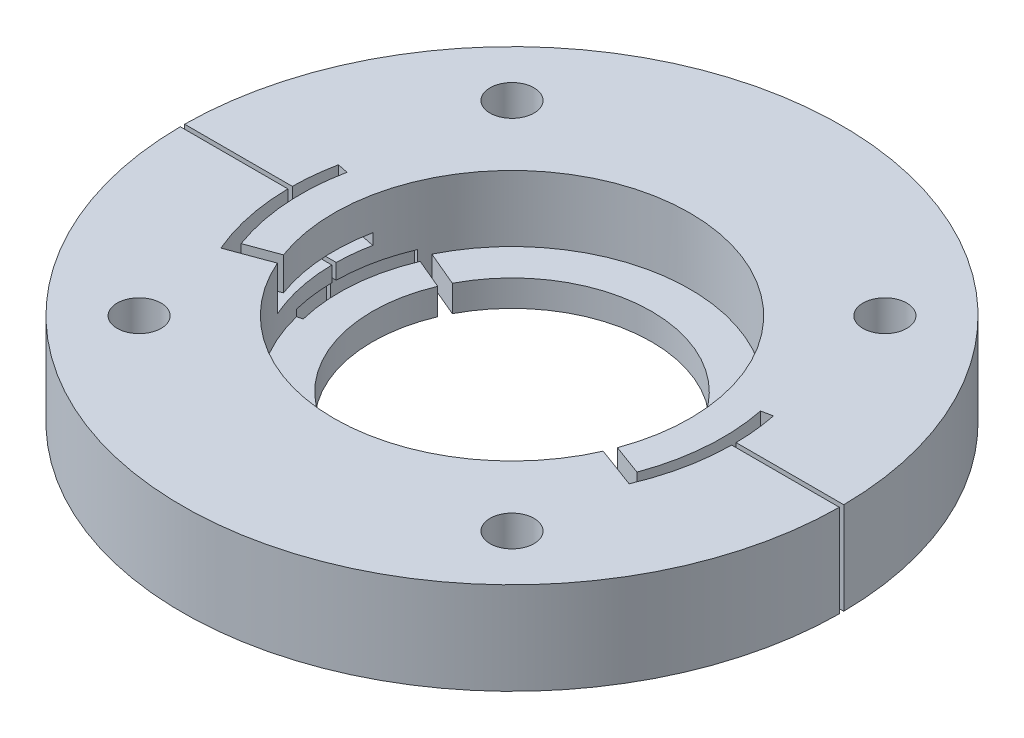
from build123d import *

# Parameters (mm, degrees)
SKETCH4_R           = 1
CUT_EXTRUDE2_DEPTH  = 25.879710609
SKETCH4_3_R         = 1.75
SKETCH4_3_R_2       = 1
CUT_EXTRUDE3_DEPTH  = 9.4
CHAMFER1_SIZE       = 1
SKETCH2_W           = 41.708786628
SKETCH2_H           = 54.576605706
CUT_EXTRUDE1_DEPTH  = 0.05
SKETCH1_5_W         = 6.9
SKETCH1_5_H         = 3
SKETCH1_5_H_2       = 1.2
SKETCH4_4_R         = 1
CUT_EXTRUDE4_DEPTH  = 27.813429471
SKETCH5_R           = 1.75
CUT_EXTRUDE5_DEPTH  = 2.9
CUT_EXTRUDE8_DEPTH  = 2
BOSS_EXTRUDE1_DEPTH = 1.5
CUT_EXTRUDE9_START  = -1.5
CUT_EXTRUDE9_DEPTH  = 1.8
BOSS_EXTRUDE2_DEPTH = 1.2
SKETCH10_W          = 7.7
SKETCH10_H          = 10
SKETCH10_W_2        = 1.8
SKETCH10_H_2        = 3.6
CUT_EXTRUDE10_DEPTH = 0.1
CUT_EXTRUDE11_DEPTH = 1.2


with BuildPart() as part:
    # Sketch1 → Revolve1 (revolve)
    with BuildSketch(Plane.XY, mode=Mode.PRIVATE) as revolve1_sk:
        Polygon((-3, 0), (-8, 0), (-8, -3.7), (-6, -3.7), (-6, -9.7), (-8, -9.7), (-8, -13), (-15, -13), (-15, -23.9), (-6.1, -23.9), (-6.1, -21), (-8.1, -21), (-8.1, -14.3), (-3, -14.3), align=None)
    revolve(revolve1_sk.sketch.rotate(Axis((0, 21.737527327, 0), (0, -1, 0)), 270), axis=Axis((0, 21.737527327, 0), (0, -1, 0)))

    # Sketch4 → Cut-Extrude2 (cut, through all)
    with BuildSketch(Plane(origin=(0, -13, 0), x_dir=(1, 0, 0), z_dir=(0, 1, 0))):
        with Locations(Location((-8.485281374, 8.485281374, 0), (0, 0, 270))):
            Circle(SKETCH4_R)
        with Locations(Location((8.485281374, 8.485281374, 0), (0, 0, 270))):
            Circle(SKETCH4_R)
        with Locations(Location((8.485281374, -8.485281374, 0), (0, 0, 270))):
            Circle(SKETCH4_R)
        with Locations(Location((-8.485281374, -8.485281374, 0), (0, 0, 270))):
            Circle(SKETCH4_R)
    extrude(amount=-CUT_EXTRUDE2_DEPTH, mode=Mode.SUBTRACT)

    # Sketch4<3> → Cut-Extrude3 (cut)
    # profile 1 of 5: a face of its own
    with BuildSketch(Plane(origin=(0, -13, 0), x_dir=(1, 0, 0), z_dir=(0, 1, 0))):
        with Locations(Location((8.485281374, 8.485281374, 0), (0, 0, 270))):
            Circle(SKETCH4_3_R)
        with Locations(Location((8.485281374, 8.485281374, 0), (0, 0, 270))):
            Circle(SKETCH4_3_R_2, mode=Mode.SUBTRACT)
    # profile 2 of 5: a face of its own
    with BuildSketch(Plane(origin=(0, -13, 0), x_dir=(1, 0, 0), z_dir=(0, 1, 0))):
        with Locations(Location((8.485281374, -8.485281374, 0), (0, 0, 270))):
            Circle(SKETCH4_3_R)
        with Locations(Location((8.485281374, -8.485281374, 0), (0, 0, 270))):
            Circle(SKETCH4_3_R_2, mode=Mode.SUBTRACT)
    # profile 3 of 5: a face of its own
    with BuildSketch(Plane(origin=(0, -13, 0), x_dir=(1, 0, 0), z_dir=(0, 1, 0))):
        with Locations(Location((-8.485281374, -8.485281374, 0), (0, 0, 270))):
            Circle(SKETCH4_3_R)
        with Locations(Location((-8.485281374, -8.485281374, 0), (0, 0, 270))):
            Circle(SKETCH4_3_R_2, mode=Mode.SUBTRACT)
    # profile 4 of 5: a face of its own
    with BuildSketch(Plane(origin=(0, -13, 0), x_dir=(1, 0, 0), z_dir=(0, 1, 0))):
        with Locations(Location((-8.485281374, 8.485281374, 0), (0, 0, 270))):
            Circle(SKETCH4_3_R_2)
    # profile 5 of 5: a face of its own
    with BuildSketch(Plane(origin=(0, -13, 0), x_dir=(1, 0, 0), z_dir=(0, 1, 0))):
        with Locations(Location((-8.485281374, 8.485281374, 0), (0, 0, 270))):
            Circle(SKETCH4_3_R)
    extrude(amount=-CUT_EXTRUDE3_DEPTH, mode=Mode.SUBTRACT)

    # Chamfer1
    chamfer1_edges = [part.edges().sort_by_distance(p)[0] for p in [
        (0, 0, -3),
    ]]
    chamfer(chamfer1_edges, length=CHAMFER1_SIZE)

    # Sketch2 → Cut-Extrude1 (cut, symmetric)
    with BuildSketch(Plane.XY):
        Rectangle(SKETCH2_W, SKETCH2_H)
    extrude(amount=CUT_EXTRUDE1_DEPTH, both=True, mode=Mode.SUBTRACT)


with BuildPart() as cut_extrude1_piece_1:
    # of the separate pieces the step leaves, piece 1, a body of its own (cut_extrude1_pieces)
    add(part.part.solids().sort_by_distance((-2.999583304, -1, 0.05))[0])


with BuildPart() as cut_extrude1_piece_2:
    # of the separate pieces the step leaves, piece 2, a body of its own (cut_extrude1_pieces)
    add(part.part.solids().sort_by_distance((-2.999583304, -1, -0.05))[0])


with BuildPart() as body_3:
    # Sketch1<5> → Revolve2 (revolve)
    with BuildSketch(Plane.XY, mode=Mode.PRIVATE) as revolve2_sk:
        with Locations((-11.55, -25.5)):
            Rectangle(SKETCH1_5_W, SKETCH1_5_H)
        Polygon((-6.35, -27), (-8.1, -27), (-15, -27), (-15, -28.2), (-8.1, -28.2), (-6.35, -28.2), align=None)
        with Locations((-11.55, -28.8)):
            Rectangle(SKETCH1_5_W, SKETCH1_5_H_2)
    revolve(revolve2_sk.sketch.rotate(Axis((0, 21.737527327, 0), (0, -1, 0)), 270), axis=Axis((0, 21.737527327, 0), (0, -1, 0)))

    # Sketch4<4> → Cut-Extrude4 (cut, through all)
    with BuildSketch(Plane(origin=(0, -13, 0), x_dir=(1, 0, 0), z_dir=(0, 1, 0))):
        with Locations(Location((8.485281374, 8.485281374, 0), (0, 0, 270))):
            Circle(SKETCH4_4_R)
        with Locations(Location((8.485281374, -8.485281374, 0), (0, 0, 270))):
            Circle(SKETCH4_4_R)
        with Locations(Location((-8.485281374, 8.485281374, 0), (0, 0, 270))):
            Circle(SKETCH4_4_R)
        with Locations(Location((-8.485281374, -8.485281374, 0), (0, 0, 270))):
            Circle(SKETCH4_4_R)
    extrude(amount=-CUT_EXTRUDE4_DEPTH, mode=Mode.SUBTRACT)

    # Sketch5 → Cut-Extrude5 (cut)
    with BuildSketch(Plane.XZ.offset(29.4)):
        with Locations(Location((8.485281374, 8.485281374, 0), (0, 0, 270))):
            Circle(SKETCH5_R)
        with Locations(Location((-8.485281374, 8.485281374, 0), (0, 0, 270))):
            Circle(SKETCH5_R)
        with Locations(Location((-8.485281374, -8.485281374, 0), (0, 0, 270))):
            Circle(SKETCH5_R)
        with Locations(Location((8.485281374, -8.485281374, 0), (0, 0, 270))):
            Circle(SKETCH5_R)
    extrude(amount=-CUT_EXTRUDE5_DEPTH, mode=Mode.SUBTRACT)

    # Sketch8 → Cut-Extrude8 (cut)
    with BuildSketch(Plane(origin=(0, -24, 0), x_dir=(1, 0, 0), z_dir=(0, 1, 0))):
        with BuildLine():
            ThreePointArc((-7.41255698, -3.265577899), (-7.509859699, -3.035128877), (-7.6, -2.801785145))
            Line((-7.6, -2.801785145), (-9.007407407, -3.320634246))
            ThreePointArc((-9.007407407, -3.320634246), (-8.917846338, -3.55415485), (-8.822232332, -3.785263092))
            Line((-8.822232332, -3.785263092), (-7.41255698, -3.265577899))
        make_face()
        with BuildLine():
            ThreePointArc((-8.822232332, -3.785263092), (-8.917846338, -3.55415485), (-9.007407407, -3.320634246))
            Line((-9.007407407, -3.320634246), (-9.47654321, -3.493583947))
            ThreePointArc((-9.47654321, -3.493583947), (-9.387136546, -3.727152729), (-9.291974114, -3.95843619))
            Line((-9.291974114, -3.95843619), (-8.822232332, -3.785263092))
        make_face()
        with BuildLine():
            Line((-9.47654321, -3.493583947), (-9.007407407, -3.320634246))
            ThreePointArc((-9.007407407, -3.320634246), (-9.571606571, -0.737799192), (-9.40990099, 1.900990099))
            Line((-9.40990099, 1.900990099), (-9.9, 2))
            ThreePointArc((-9.9, 2), (-10.070127747, -0.776226233), (-9.47654321, -3.493583947))
        make_face()
        with BuildLine():
            Line((-9.007407407, -3.320634246), (-7.6, -2.801785145))
            ThreePointArc((-7.6, -2.801785145), (-7.974020316, -1.423024947), (-8.1, 0))
            ThreePointArc((-8.1, 0), (-8.059801241, 0.805980124), (-7.93960396, 1.603960396))
            Line((-7.93960396, 1.603960396), (-9.40990099, 1.900990099))
            ThreePointArc((-9.40990099, 1.900990099), (-9.571606571, -0.737799192), (-9.007407407, -3.320634246))
        make_face()
    cut_extrude8 = extrude(amount=-CUT_EXTRUDE8_DEPTH, mode=Mode.SUBTRACT)

    # Sketch8<3> → Boss-Extrude1 (add)
    with BuildSketch(Plane(origin=(0, -24, 0), x_dir=(1, 0, 0), z_dir=(0, 1, 0))):
        with BuildLine():
            Line((-9.007407407, -3.320634246), (-7.6, -2.801785145))
            ThreePointArc((-7.6, -2.801785145), (-7.974020316, -1.423024947), (-8.1, 0))
            ThreePointArc((-8.1, 0), (-8.059801241, 0.805980124), (-7.93960396, 1.603960396))
            Line((-7.93960396, 1.603960396), (-9.40990099, 1.900990099))
            ThreePointArc((-9.40990099, 1.900990099), (-9.571606571, -0.737799192), (-9.007407407, -3.320634246))
        make_face()
    boss_extrude1 = extrude(amount=-BOSS_EXTRUDE1_DEPTH)

    # Sketch9 → Cut-Extrude9 (cut)
    with BuildSketch(Plane(origin=(0, -27, 0), x_dir=(1, 0, 0), z_dir=(0, 1, 0)).offset(CUT_EXTRUDE9_START)):
        with BuildLine():
            ThreePointArc((-7.621495873, -1.880239521), (-7.825635414, 0.618005155), (-7.231889764, 3.053239336))
            Line((-7.231889764, 3.053239336), (-7.462204724, 3.150476258))
            ThreePointArc((-7.462204724, 3.150476258), (-8.074859471, 0.637686848), (-7.864218672, -1.94011976))
            Line((-7.864218672, -1.94011976), (-7.621495873, -1.880239521))
        make_face()
        with BuildLine():
            ThreePointArc((-7.864218672, -1.94011976), (-8.074859471, 0.637686848), (-7.462204724, 3.150476258))
            Line((-7.462204724, 3.150476258), (-7.692519685, 3.247713179))
            ThreePointArc((-7.692519685, 3.247713179), (-8.324083529, 0.657368541), (-8.10694147, -2))
            Line((-8.10694147, -2), (-7.864218672, -1.94011976))
        make_face()
        with BuildLine():
            Line((-7.462204724, 3.150476258), (-7.231889764, 3.053239336))
            ThreePointArc((-7.231889764, 3.053239336), (-7.130931349, 3.282120976), (-7.022731269, 3.507669529))
            Line((-7.022731269, 3.507669529), (-7.25350034, 3.605098171))
            ThreePointArc((-7.25350034, 3.605098171), (-7.361362928, 3.37939874), (-7.462204724, 3.150476258))
        make_face()
        with BuildLine():
            Line((-7.231889764, 3.053239336), (-5.85, 2.469817807))
            ThreePointArc((-5.85, 2.469817807), (-5.748144943, 2.698393915), (-5.637362924, 2.922779373))
            Line((-5.637362924, 2.922779373), (-7.022731269, 3.507669529))
            ThreePointArc((-7.022731269, 3.507669529), (-7.130931349, 3.282120976), (-7.231889764, 3.053239336))
        make_face()
        with BuildLine():
            ThreePointArc((-6.35, 0), (-6.223744853, 1.259960317), (-5.85, 2.469817807))
            Line((-5.85, 2.469817807), (-7.231889764, 3.053239336))
            ThreePointArc((-7.231889764, 3.053239336), (-7.825635414, 0.618005155), (-7.621495873, -1.880239521))
            Line((-7.621495873, -1.880239521), (-6.165159082, -1.520958084))
            ThreePointArc((-6.165159082, -1.520958084), (-6.303620395, -0.766074353), (-6.35, 0))
        make_face()
    cut_extrude9 = extrude(amount=CUT_EXTRUDE9_DEPTH, mode=Mode.SUBTRACT)

    # Sketch9<3> → Boss-Extrude2 (add)
    with BuildSketch(Plane(origin=(0, -27, 0), x_dir=(1, 0, 0), z_dir=(0, 1, 0))):
        with BuildLine():
            ThreePointArc((-6.35, 0), (-6.223744853, 1.259960317), (-5.85, 2.469817807))
            Line((-5.85, 2.469817807), (-7.231889764, 3.053239336))
            ThreePointArc((-7.231889764, 3.053239336), (-7.825635414, 0.618005155), (-7.621495873, -1.880239521))
            Line((-7.621495873, -1.880239521), (-6.165159082, -1.520958084))
            ThreePointArc((-6.165159082, -1.520958084), (-6.303620395, -0.766074353), (-6.35, 0))
        make_face()
    boss_extrude2 = extrude(amount=-BOSS_EXTRUDE2_DEPTH)

    # Sketch10 → Cut-Extrude10 (cut, symmetric)
    with BuildSketch(Plane.XY):
        with Locations((-13.65, -24.4)):
            Rectangle(SKETCH10_W, SKETCH10_H)
        with Locations((-8.9, -27.6)):
            Rectangle(SKETCH10_W_2, SKETCH10_H_2)
    cut_extrude10 = extrude(amount=CUT_EXTRUDE10_DEPTH, both=True, mode=Mode.SUBTRACT)

    # Mirror1: Cut-Extrude8, Boss-Extrude1, Cut-Extrude9, Boss-Extrude2, Cut-Extrude10 across plane
    add(cut_extrude8.mirror(Plane(origin=(0, 0, 0), x_dir=(0, 0, 1), z_dir=(1, 0, 0))), mode=Mode.SUBTRACT)
    add(boss_extrude1.mirror(Plane(origin=(0, 0, 0), x_dir=(0, 0, 1), z_dir=(1, 0, 0))))
    add(cut_extrude9.mirror(Plane(origin=(0, 0, 0), x_dir=(0, 0, 1), z_dir=(1, 0, 0))), mode=Mode.SUBTRACT)
    add(boss_extrude2.mirror(Plane(origin=(0, 0, 0), x_dir=(0, 0, 1), z_dir=(1, 0, 0))))
    add(cut_extrude10.mirror(Plane(origin=(0, 0, 0), x_dir=(0, 0, 1), z_dir=(1, 0, 0))), mode=Mode.SUBTRACT)

    # Sketch11 → Cut-Extrude11 (cut)
    with BuildSketch(Plane.XZ.offset(29.4)):
        with BuildLine():
            Line((8.099382693, 0.1), (14.999666663, 0.1))
            ThreePointArc((14.999666663, 0.1), (0, 15), (-14.999666663, 0.1))
            Line((-14.999666663, 0.1), (-8.099382693, 0.1))
            ThreePointArc((-8.099382693, 0.1), (0, 8.1), (8.099382693, 0.1))
        make_face()
        with BuildLine():
            Line((14.999666663, -0.1), (8.099382693, -0.1))
            ThreePointArc((8.099382693, -0.1), (0, -8.1), (-8.099382693, -0.1))
            Line((-8.099382693, -0.1), (-14.999666663, -0.1))
            ThreePointArc((-14.999666663, -0.1), (0, -15), (14.999666663, -0.1))
        make_face()
    extrude(amount=-CUT_EXTRUDE11_DEPTH, mode=Mode.SUBTRACT)


solid = body_3.part
